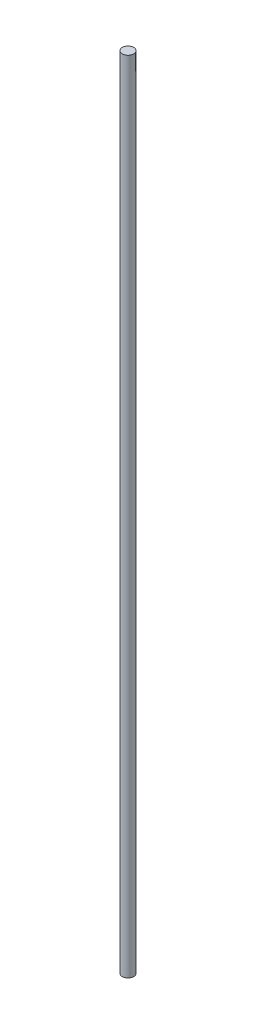
from build123d import *

# Parameters (mm, degrees)
SKETCH1_R           = 6.35
BOSS_EXTRUDE1_DEPTH = 892


with BuildPart() as part:
    # Sketch1 → Boss-Extrude1 (new body)
    with BuildSketch(Plane(origin=(0, 0, 0), x_dir=(1, 0, 0), z_dir=(0, 1, 0))):
        with Locations(Location((0, 0, 0), (0, 0, 90))):
            Circle(SKETCH1_R)
    extrude(amount=BOSS_EXTRUDE1_DEPTH)


solid = part.part
